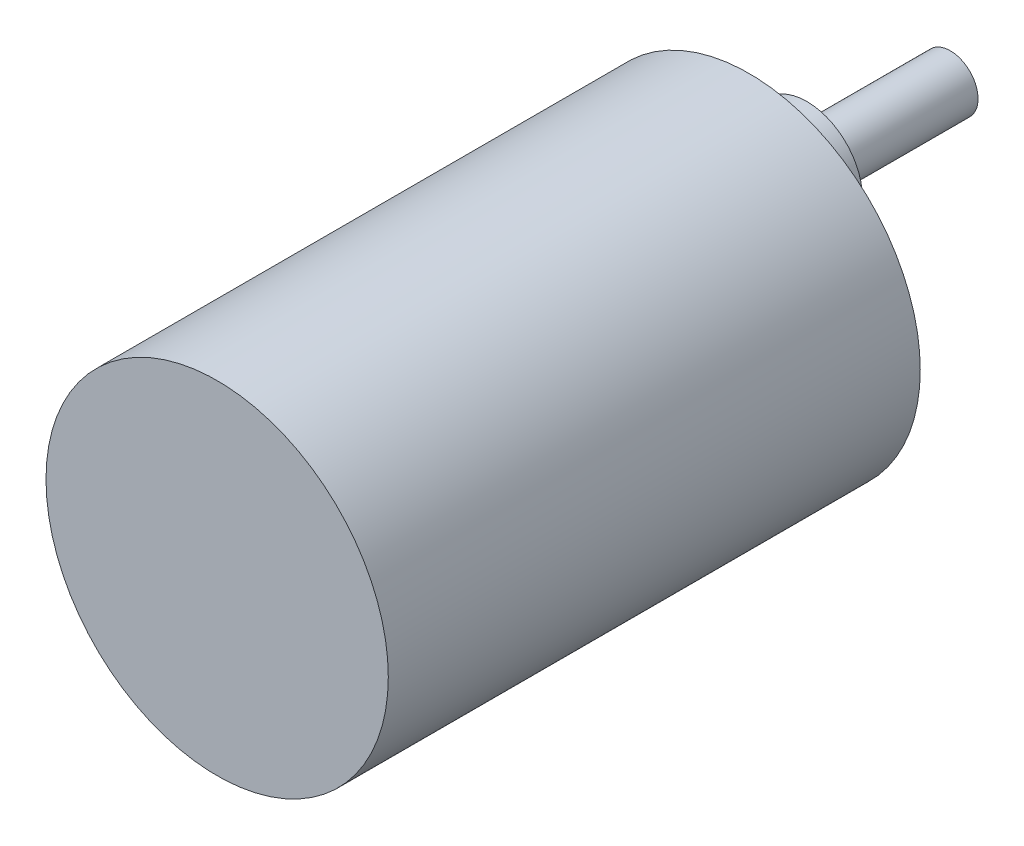
from build123d import *

# Parameters (mm, degrees)
SKETCH_1_R          = 18.5
EXTRUDE_1_DEPTH     = 46
SKETCH_1_3_R        = 1.5
CUT_EXTRUDE_1_DEPTH = 6
SKETCH_2_R          = 6
EXTRUDE_2_DEPTH     = 6
SKETCH_3_R          = 3
EXTRUDE_3_DEPTH     = 15.5
SKETCH_5_R          = 18.5
EXTRUDE_4_DEPTH     = 11.5


with BuildPart() as part:
    # 草图1 → 凸台-拉伸1 (new body)
    with BuildSketch(Plane.XY):
        Circle(SKETCH_1_R)
    extrude(amount=EXTRUDE_1_DEPTH)

    # 草图1<3> → 切除-拉伸1 (cut)
    with BuildSketch(Plane.XY):
        with Locations((15.490383309, -0.545916592)):
            Circle(SKETCH_1_3_R)
        with Locations((7.272414017, -13.688023757)):
            Circle(SKETCH_1_3_R)
        with Locations((-8.217969292, -13.142107164)):
            Circle(SKETCH_1_3_R)
        with Locations((-15.490383309, 0.545916592)):
            Circle(SKETCH_1_3_R)
        with Locations((-7.272414017, 13.688023757)):
            Circle(SKETCH_1_3_R)
        with Locations((8.217969292, 13.142107164)):
            Circle(SKETCH_1_3_R)
    extrude(amount=CUT_EXTRUDE_1_DEPTH, mode=Mode.SUBTRACT)

    # 草图2 → 凸台-拉伸2 (add)
    with BuildSketch(Plane(origin=(0, 0, 0), x_dir=(-1, 0, 0), z_dir=(0, 0, -1))):
        with Locations((-0.246542977, 6.995656978)):
            Circle(SKETCH_2_R)
    extrude(amount=EXTRUDE_2_DEPTH)

    # 草图3 → 凸台-拉伸3 (add)
    with BuildSketch(Plane(origin=(0, 0, -6), x_dir=(-1, 0, 0), z_dir=(0, 0, -1))):
        with Locations((-0.246542977, 6.995656978)):
            Circle(SKETCH_3_R)
    extrude(amount=EXTRUDE_3_DEPTH)

    # 草图5 → 凸台-拉伸4 (add)
    with BuildSketch(Plane.XY.offset(46)):
        Circle(SKETCH_5_R)
    extrude(amount=EXTRUDE_4_DEPTH)


solid = part.part
